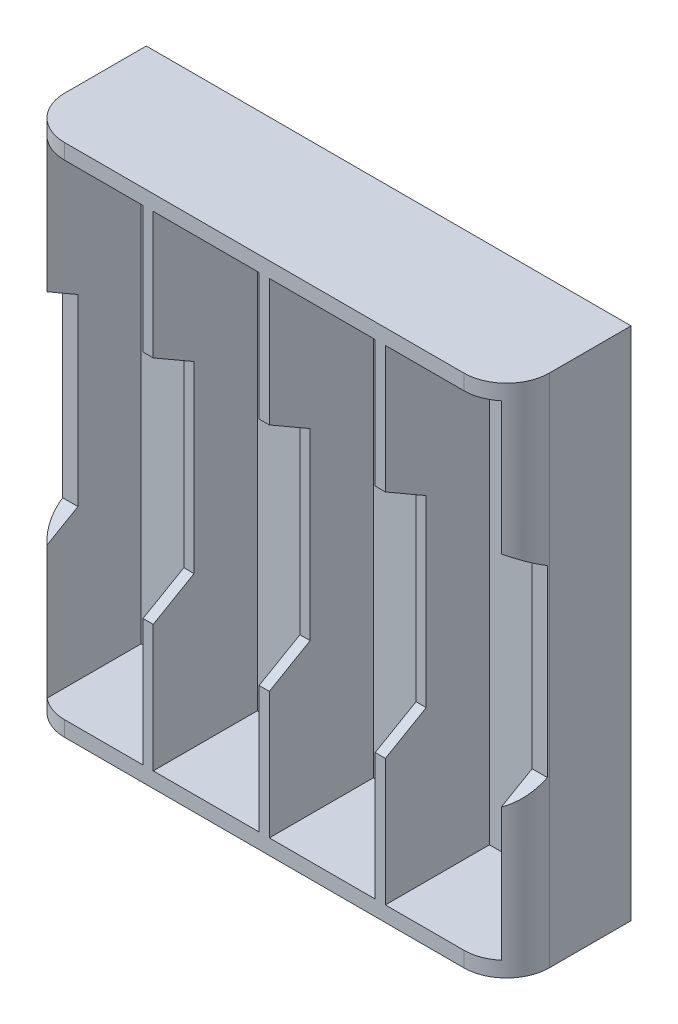
from build123d import *

# Parameters (mm, degrees)
SKETCH1_W               = 47.52
SKETCH1_H               = 50.5
BOSS_EXTRUDE1_DEPTH     = 2
BOSS_EXTRUDE2_DEPTH     = 50.5
SKETCH3_W               = 10.38
SKETCH3_H               = 47.5
CUT_EXTRUDE1_DEPTH      = 10.2
CUT_EXTRUDE2_DEPTH      = 37.755137056
CUT_EXTRUDE2_DEPTH_BACK = 37.755137056


with BuildPart() as part:
    # Sketch1 → Boss-Extrude1 (new body)
    with BuildSketch(Plane.XY):
        Rectangle(SKETCH1_W, SKETCH1_H)
    extrude(amount=BOSS_EXTRUDE1_DEPTH)

    # Sketch2 → Boss-Extrude2 (add)
    with BuildSketch(Plane.XZ.offset(25.25)):
        with BuildLine():
            Line((-19.56, 12.2), (19.56, 12.2))
            ThreePointArc((19.56, 12.2), (22.529848481, 10.969848481), (23.76, 8))
            Line((23.76, 8), (23.76, 2))
            Line((23.76, 2), (-23.76, 2))
            Line((-23.76, 2), (-23.76, 8))
            ThreePointArc((-23.76, 8), (-22.529848481, 10.969848481), (-19.56, 12.2))
        make_face()
    extrude(amount=-BOSS_EXTRUDE2_DEPTH)

    # Sketch3 → Cut-Extrude1 (cut)
    with BuildSketch(Plane.XY.offset(12.2)):
        with Locations((-17.07, 0)):
            Rectangle(SKETCH3_W, SKETCH3_H)
        with Locations((-5.69, 0)):
            Rectangle(SKETCH3_W, SKETCH3_H)
        with Locations((5.69, 0)):
            Rectangle(SKETCH3_W, SKETCH3_H)
        with Locations((17.07, 0)):
            Rectangle(SKETCH3_W, SKETCH3_H)
    extrude(amount=-CUT_EXTRUDE1_DEPTH, mode=Mode.SUBTRACT)

    # Sketch4 → Cut-Extrude2 (cut, two sides: drawn at the far end of the back side and taken through both)
    with BuildSketch(Plane(origin=(0, 0, 0), x_dir=(0, 0, -1), z_dir=(1, 0, 0)).offset(-CUT_EXTRUDE2_DEPTH_BACK)):
        Polygon((-17.2, -14.196152423), (-17.2, 14.196152423), (-8.2, 9), (-8.2, -9), align=None)
    extrude(amount=CUT_EXTRUDE2_DEPTH + CUT_EXTRUDE2_DEPTH_BACK, mode=Mode.SUBTRACT)


solid = part.part
